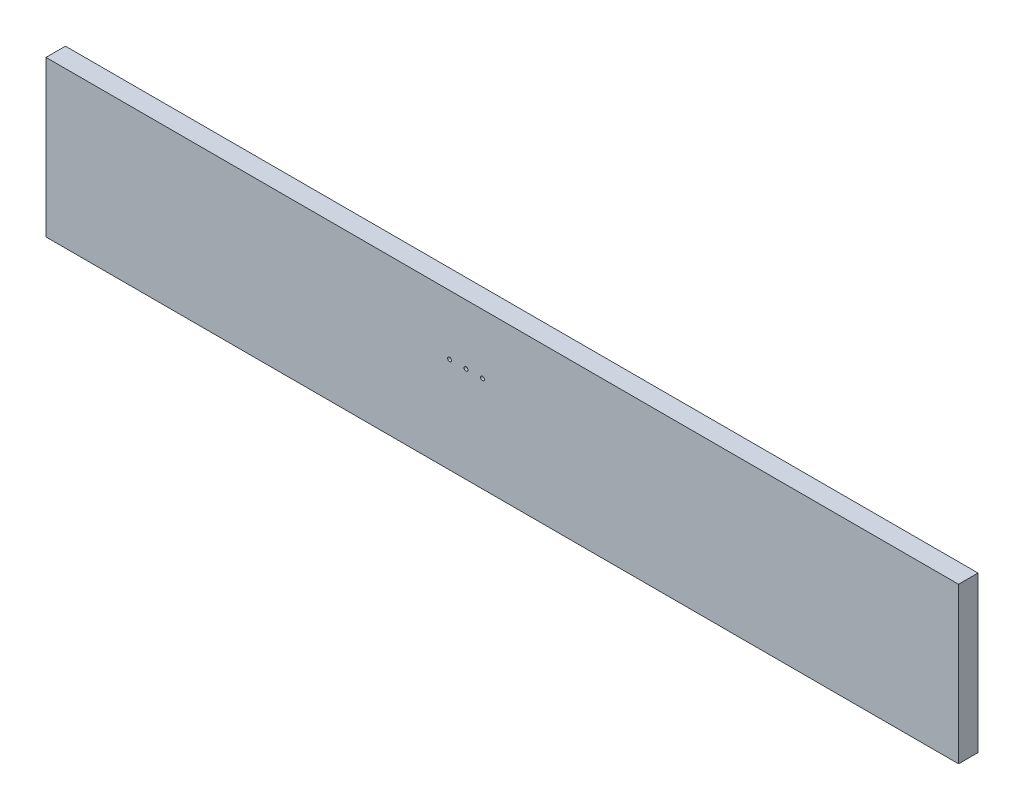
from build123d import *

# Parameters (mm, degrees)
SKETCH_1_W          = 704
SKETCH_1_H          = 120
EXTRUDE_1_DEPTH     = 15
SKETCH_2_R          = 1.5
CUT_EXTRUDE_1_DEPTH = 358.391941711


with BuildPart() as part:
    # 草图1 → 凸台-拉伸1 (new body)
    with BuildSketch(Plane.XY):
        Rectangle(SKETCH_1_W, SKETCH_1_H)
    extrude(amount=EXTRUDE_1_DEPTH)

    # 草图2 → 切除-拉伸1 (cut, through all)
    with BuildSketch(Plane.XY.offset(15)):
        with Locations((-15.29, 13.9)):
            Circle(SKETCH_2_R)
        with Locations((-27.99, 13.9)):
            Circle(SKETCH_2_R)
        with Locations((-40.69, 13.9)):
            Circle(SKETCH_2_R)
    extrude(amount=-CUT_EXTRUDE_1_DEPTH, mode=Mode.SUBTRACT)


solid = part.part
